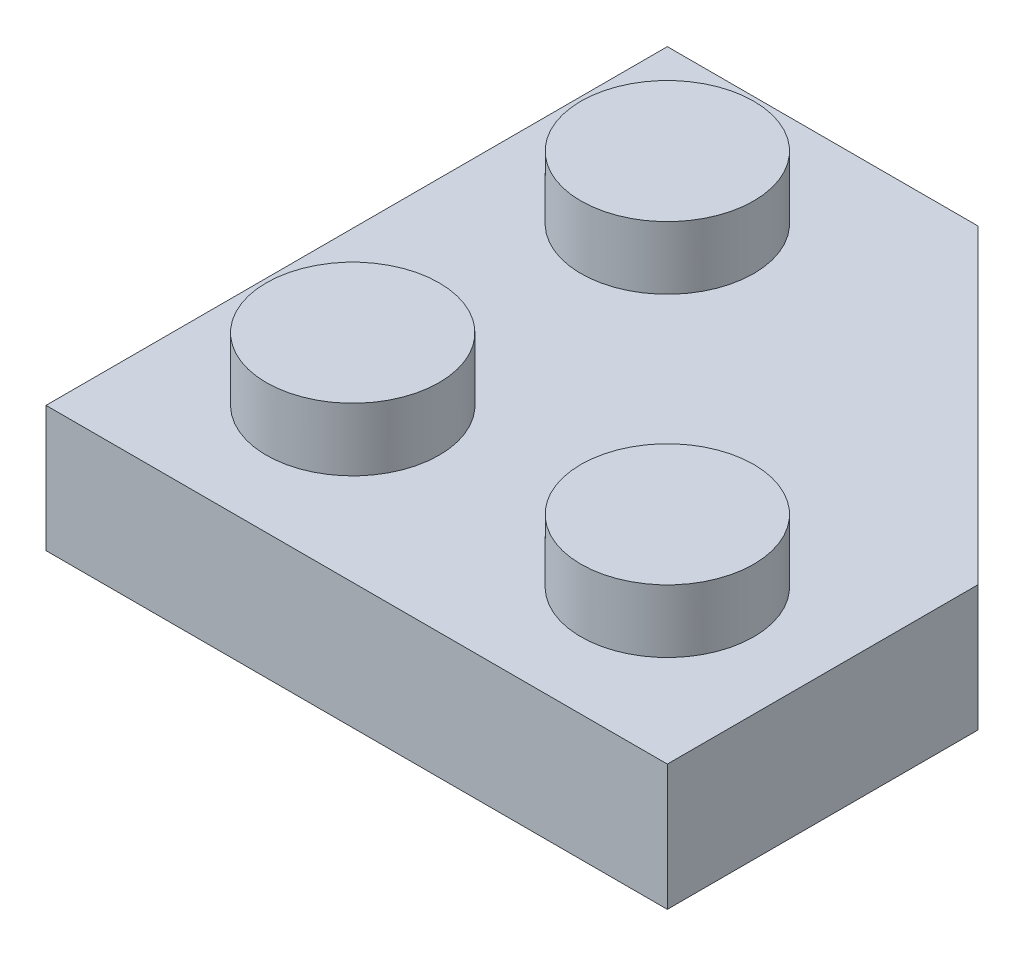
from build123d import *

# Parameters (mm, degrees)
BASEFRAMESKETCH_W           = 15.8
BASEFRAMESKETCH_H           = 3.2
BASEFRAME_DEPTH             = 7.9
STUDSSKETCH_R               = 2.197938665
STUDS_DEPTH                 = 1.6
MAINSTUDSPATTERN_COUNT      = 2
MAINSTUDSPATTERN_PITCH      = 8
MAINSTUDSPATTERN_COUNT_DIR2 = 2
MAINSTUDSPATTERN_PITCH_DIR2 = 8
MAINBASESHELL_T             = -1.2
UNDERCIRCLESKETCH_R         = 3.25
UNDERCIRCLESKETCH_R_2       = 2.4
UNDERCIRCLEEXTRUDE_DEPTH    = 1.8
CUT_EXTRUDE42_DEPTH         = 16.116827041
SKETCH116_R                 = 2.316021132
CUT_EXTRUDE43_DEPTH         = 5
BOSS_EXTRUDE26_START        = -1.2
BOSS_EXTRUDE26_DEPTH        = 1.2


with BuildPart() as part:
    # BaseFrameSketch → BaseFrame (new, symmetric)
    with BuildSketch(Plane.XY):
        with Locations((-4.584729064, 1.6)):
            Rectangle(BASEFRAMESKETCH_W, BASEFRAMESKETCH_H)
    extrude(amount=BASEFRAME_DEPTH, both=True)

    # StudsSketch → Studs (add)
    with BuildSketch(Plane(origin=(0, 3.2, 0), x_dir=(1, 0, 0), z_dir=(0, 1, 0))):
        with Locations((-8.584729064, 4)):
            Circle(STUDSSKETCH_R)
    studs = extrude(amount=STUDS_DEPTH)

    # MainStudsPattern: Studs 2 × 2
    with Locations(*[(i * MAINSTUDSPATTERN_PITCH, 0, j * MAINSTUDSPATTERN_PITCH_DIR2) for i in range(MAINSTUDSPATTERN_COUNT) for j in range(MAINSTUDSPATTERN_COUNT_DIR2) if (i, j) != (0, 0)]):
        add(studs)

    # MainBaseShell
    mainbaseshell_openings = [part.faces().sort_by_distance(p)[0] for p in [
        (-4.584729064, 0, 0),
    ]]
    offset(amount=MAINBASESHELL_T, openings=mainbaseshell_openings, kind=Kind.INTERSECTION)

    # UnderCircleSketch → UnderCircleExtrude (add)
    with BuildSketch(Plane(origin=(0, 2, 0), x_dir=(-1, 0, 0), z_dir=(0, -1, 0))):
        with Locations(Location((4.584729064, 0, 0), (0, 0, 270))):
            Circle(UNDERCIRCLESKETCH_R)
        with Locations(Location((4.584729064, 0, 0), (0, 0, 270))):
            Circle(UNDERCIRCLESKETCH_R_2, mode=Mode.SUBTRACT)
    extrude(amount=UNDERCIRCLEEXTRUDE_DEPTH)

    # Sketch115 → Cut-Extrude42 (cut, through all)
    with BuildSketch(Plane(origin=(0, 3.2, 0), x_dir=(1, 0, 0), z_dir=(0, 1, 0))):
        Polygon((-4.584729064, 7.9), (3.315270936, 7.9), (3.315270936, 0), align=None)
    extrude(amount=-CUT_EXTRUDE42_DEPTH, mode=Mode.SUBTRACT)

    # Sketch116 → Cut-Extrude43 (cut)
    with BuildSketch(Plane(origin=(0, 3.2, 0), x_dir=(1, 0, 0), z_dir=(0, 1, 0))):
        with Locations((-0.622263627, 3.930816352)):
            Circle(SKETCH116_R)
    extrude(amount=CUT_EXTRUDE43_DEPTH, mode=Mode.SUBTRACT)

    # Sketch117 → Boss-Extrude26 (add)
    with BuildSketch(Plane(origin=(0, 3.2, 0), x_dir=(1, 0, 0), z_dir=(0, 1, 0)).offset(BOSS_EXTRUDE26_START)):
        with BuildLine():
            Line((-1.338604614, 4.65387555), (0.069146486, 3.24612445))
            ThreePointArc((0.069146486, 3.24612445), (-1.290378261, 3.294350803), (-1.338604614, 4.65387555))
        make_face()
    extrude(amount=BOSS_EXTRUDE26_DEPTH)


solid = part.part
